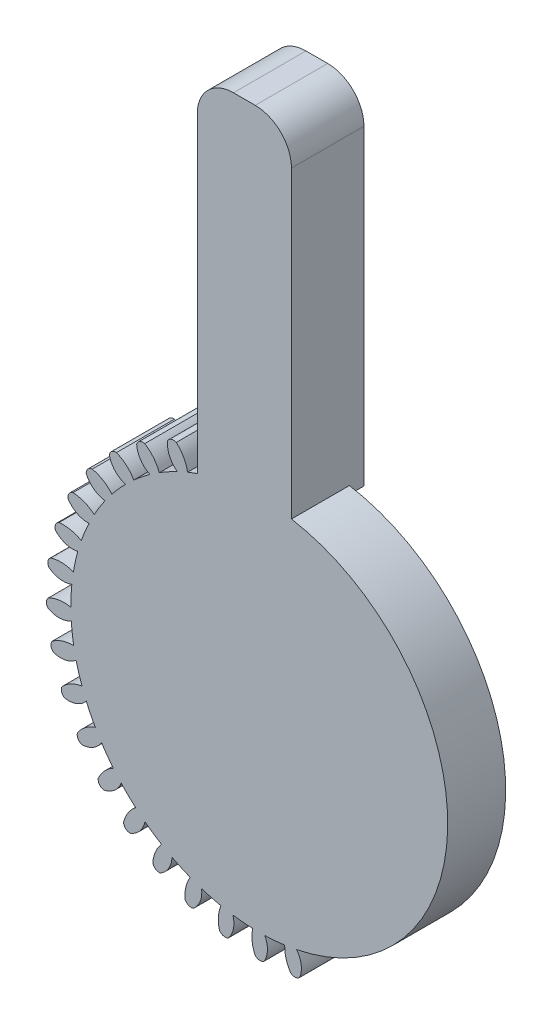
from build123d import *

# Parameters (mm, degrees)
SKETCH1_R           = 13
BOSS_EXTRUDE1_DEPTH = 4
BOSS_EXTRUDE2_DEPTH = 4
CIRPATTERN1_COUNT   = 37
CUT_EXTRUDE1_START  = -6
CUT_EXTRUDE1_DEPTH  = 6
SKETCH5_W           = 6.5
SKETCH5_H           = 24
BOSS_EXTRUDE3_DEPTH = 5
FILLET1_R           = 2.5


with BuildPart() as part:
    # Sketch1 → Boss-Extrude1 (new body)
    with BuildSketch(Plane.XY):
        Circle(SKETCH1_R)
    extrude(amount=BOSS_EXTRUDE1_DEPTH)

    # Sketch2 → Boss-Extrude2 (add)
    with BuildSketch(Plane.XY.offset(4)):
        with BuildLine():
            Line((-1.442756516, 12.919692475), (-0.673396871, 12.982547387))
            ThreePointArc((-0.673396871, 12.982547387), (-0.676161598, 13.791154594), (-0.946073249, 14.553388784))
            ThreePointArc((-0.946073249, 14.553388784), (-1.263795502, 14.68499365), (-1.581517754, 14.553388784))
            ThreePointArc((-1.581517754, 14.553388784), (-1.735779337, 13.717545135), (-1.442756516, 12.919692475))
        make_face()
    boss_extrude2 = extrude(amount=-BOSS_EXTRUDE2_DEPTH)

    # CirPattern1: Boss-Extrude2 ×37 about axis
    cirpattern1_axis = Axis((-0.003550518, 0.04085181, 0), (0, 0, 1))
    for i in range(1, CIRPATTERN1_COUNT):
        add(boss_extrude2.rotate(cirpattern1_axis, i * 360 / CIRPATTERN1_COUNT))

    # Sketch3 → Cut-Extrude1 (cut)
    with BuildSketch(Plane.XY.offset(4).offset(CUT_EXTRUDE1_START)):
        with BuildLine():
            ThreePointArc((2.580226265, -12.741366976), (12.998773331, -0.178582984), (2.929279614, 12.665674911))
            ThreePointArc((2.929279614, 12.665674911), (2.706489738, 14.000196281), (3.492602617, 15.101381624))
            ThreePointArc((3.492602617, 15.101381624), (15.498537433, -0.212925866), (3.076423624, -15.191629856))
            ThreePointArc((3.076423624, -15.191629856), (3.335791003, -13.863732578), (2.580226265, -12.741366976))
        make_face()
    extrude(amount=CUT_EXTRUDE1_DEPTH, mode=Mode.SUBTRACT)

    # Sketch5 → Boss-Extrude3 (add)
    with BuildSketch(Plane.XY.offset(4)):
        with Locations((-1.029483868, 24.275423326)):
            Rectangle(SKETCH5_W, SKETCH5_H)
    extrude(amount=-BOSS_EXTRUDE3_DEPTH)

    # Fillet1
    fillet1_edges = [part.edges().sort_by_distance(p)[0] for p in [
        (2.220516132, 36.275423326, 1.5),
        (-4.279483868, 36.275423326, 1.5),
    ]]
    fillet(fillet1_edges, radius=FILLET1_R)


solid = part.part
